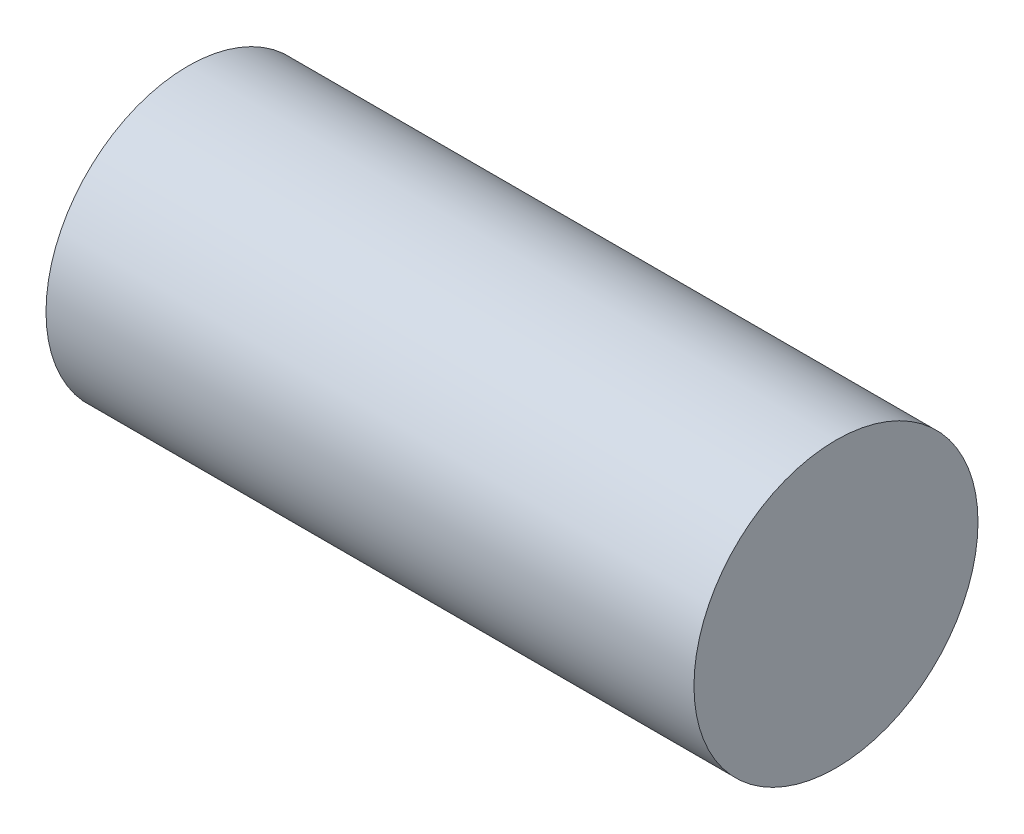
from build123d import *

# Parameters (mm, degrees)
SKETCH1_R           = 38.1
BOSS_EXTRUDE1_DEPTH = 173.8376


with BuildPart() as part:
    # Sketch1 → Boss-Extrude1 (new body)
    with BuildSketch(Plane(origin=(0, 0, 0), x_dir=(0, 0, -1), z_dir=(1, 0, 0))):
        with Locations(Location((0, 0, 0), (0, 0, 180))):
            Circle(SKETCH1_R)
    extrude(amount=BOSS_EXTRUDE1_DEPTH)


solid = part.part
